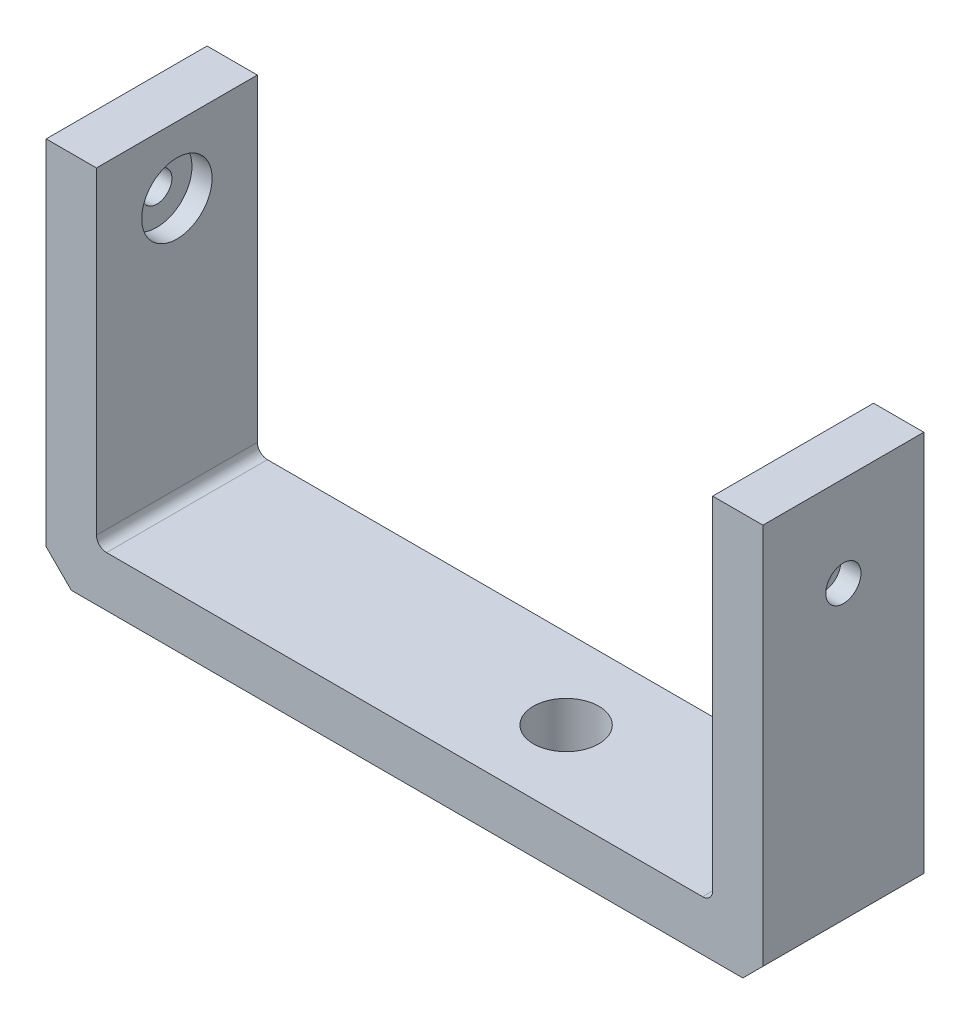
from build123d import *

# Parameters (mm, degrees)
BOSS_EXTRUDE1_DEPTH = 16
SKETCH2_R           = 3.25
CUT_EXTRUDE1_DEPTH  = 20
FILLET1_R           = 1
CHAMFER1_SIZE       = 2
SKETCH3_R           = 1.75
CUT_EXTRUDE2_DEPTH  = 20
SKETCH4_R           = 3
CUT_EXTRUDE3_DEPTH  = 3
BOSS_EXTRUDE2_START = 2
SKETCH5_R           = 3
BOSS_EXTRUDE2_DEPTH = 2
SKETCH6_R           = 1
CUT_EXTRUDE4_DEPTH  = 2
SKETCH7_W           = 16
SKETCH7_H           = 5
BOSS_EXTRUDE3_DEPTH = 37
SKETCH8_W           = 5
SKETCH8_H           = 16
BOSS_EXTRUDE4_DEPTH = 37
CUT_EXTRUDE5_START  = -87
SKETCH9_R           = 1
CUT_EXTRUDE5_DEPTH  = 87
SKETCH10_R          = 3.5
CUT_EXTRUDE6_DEPTH  = 2
SKETCH11_R          = 1.5
CUT_EXTRUDE7_DEPTH  = 12
CHAMFER2_SIZE       = 2.5
FILLET2_R           = 1
SKETCH12_W          = 16
SKETCH12_H          = 4.376308933
CUT_EXTRUDE8_DEPTH  = 12


with BuildPart() as part:
    # Sketch1 → Boss-Extrude1 (new body)
    with BuildSketch(Plane.XY):
        Polygon((16.379310345, 29.517241379), (11.379310345, 29.517241379), (11.379310345, -5.482758621), (-17.896551724, -5.482758621), (-17.896551724, -10.482758621), (16.379310345, -10.482758621), align=None)
    extrude(amount=BOSS_EXTRUDE1_DEPTH)

    # Sketch2 → Cut-Extrude1 (cut)
    with BuildSketch(Plane(origin=(0, -5.482758621, 0), x_dir=(1, 0, 0), z_dir=(0, 1, 0))):
        with Locations(Location((-11.192164188, -8, 0), (0, 0, 270))):
            Circle(SKETCH2_R)
    extrude(amount=-CUT_EXTRUDE1_DEPTH, mode=Mode.SUBTRACT)

    # Fillet1
    fillet1_edges = [part.edges().sort_by_distance(p)[0] for p in [
        (11.379310345, -5.482758621, 8),
    ]]
    fillet(fillet1_edges, radius=FILLET1_R)

    # Chamfer1
    chamfer1_edges = [part.edges().sort_by_distance(p)[0] for p in [
        (16.379310345, -10.482758621, 8),
    ]]
    chamfer(chamfer1_edges, length=CHAMFER1_SIZE)

    # Sketch3 → Cut-Extrude2 (cut)
    with BuildSketch(Plane.ZY.offset(-11.379310345)):
        with Locations(Location((8, 20.517241379, 0), (0, 0, 270))):
            Circle(SKETCH3_R)
    extrude(amount=-CUT_EXTRUDE2_DEPTH, mode=Mode.SUBTRACT)

    # Sketch4 → Cut-Extrude3 (cut)
    with BuildSketch(Plane.ZY.offset(-11.379310345)):
        with Locations(Location((8, 20.517241379, 0), (0, 0, 270))):
            Circle(SKETCH4_R)
    extrude(amount=-CUT_EXTRUDE3_DEPTH, mode=Mode.SUBTRACT)

    # Sketch5 → Boss-Extrude2 (add)
    with BuildSketch(Plane.ZY.offset(-14.379310345).offset(BOSS_EXTRUDE2_START)):
        with Locations(Location((8, 20.517241379, 0), (0, 0, 270))):
            Circle(SKETCH5_R)
    extrude(amount=-BOSS_EXTRUDE2_DEPTH)

    # Sketch6 → Cut-Extrude4 (cut)
    with BuildSketch(Plane.ZY.offset(-12.379310345)):
        with Locations(Location((8, 20.517241379, 0), (0, 0, 270))):
            Circle(SKETCH6_R)
    extrude(amount=-CUT_EXTRUDE4_DEPTH, mode=Mode.SUBTRACT)

    # Sketch7 → Boss-Extrude3 (add)
    with BuildSketch(Plane.ZY.offset(17.896551724)):
        with Locations((8, -7.982758621)):
            Rectangle(SKETCH7_W, SKETCH7_H)
    extrude(amount=BOSS_EXTRUDE3_DEPTH)

    # Sketch8 → Boss-Extrude4 (add)
    with BuildSketch(Plane(origin=(0, -5.482758621, 0), x_dir=(1, 0, 0), z_dir=(0, 1, 0))):
        with Locations((-52.396551724, -8)):
            Rectangle(SKETCH8_W, SKETCH8_H)
    extrude(amount=BOSS_EXTRUDE4_DEPTH)

    # Sketch9 → Cut-Extrude5 (cut)
    with BuildSketch(Plane(origin=(14.379310345, 0, 0), x_dir=(0, 0, -1), z_dir=(1, 0, 0)).offset(CUT_EXTRUDE5_START)):
        with Locations(Location((-8, 20.517241379, 0), (0, 0, 270))):
            Circle(SKETCH9_R)
    extrude(amount=CUT_EXTRUDE5_DEPTH, mode=Mode.SUBTRACT)

    # Sketch10 → Cut-Extrude6 (cut)
    with BuildSketch(Plane(origin=(-49.896551724, 0, 0), x_dir=(0, 0, -1), z_dir=(1, 0, 0))):
        with Locations((-8, 20.517241379)):
            Circle(SKETCH10_R)
    extrude(amount=-CUT_EXTRUDE6_DEPTH, mode=Mode.SUBTRACT)

    # Sketch11 → Cut-Extrude7 (cut)
    with BuildSketch(Plane(origin=(-51.896551724, 0, 0), x_dir=(0, 0, -1), z_dir=(1, 0, 0))):
        with Locations((-8, 20.517241379)):
            Circle(SKETCH11_R)
    extrude(amount=-CUT_EXTRUDE7_DEPTH, mode=Mode.SUBTRACT)

    # Chamfer2
    chamfer2_edges = [part.edges().sort_by_distance(p)[0] for p in [
        (-54.896551724, -10.482758621, 8),
    ]]
    chamfer(chamfer2_edges, length=CHAMFER2_SIZE)

    # Fillet2
    fillet2_edges = [part.edges().sort_by_distance(p)[0] for p in [
        (-49.896551724, -5.482758621, 8),
    ]]
    fillet(fillet2_edges, radius=FILLET2_R)

    # Sketch12 → Cut-Extrude8 (cut)
    with BuildSketch(Plane(origin=(-49.896551724, 0, 0), x_dir=(0, 0, -1), z_dir=(1, 0, 0))):
        with Locations((-8, 29.329086913)):
            Rectangle(SKETCH12_W, SKETCH12_H)
    extrude(amount=-CUT_EXTRUDE8_DEPTH, mode=Mode.SUBTRACT)


solid = part.part
